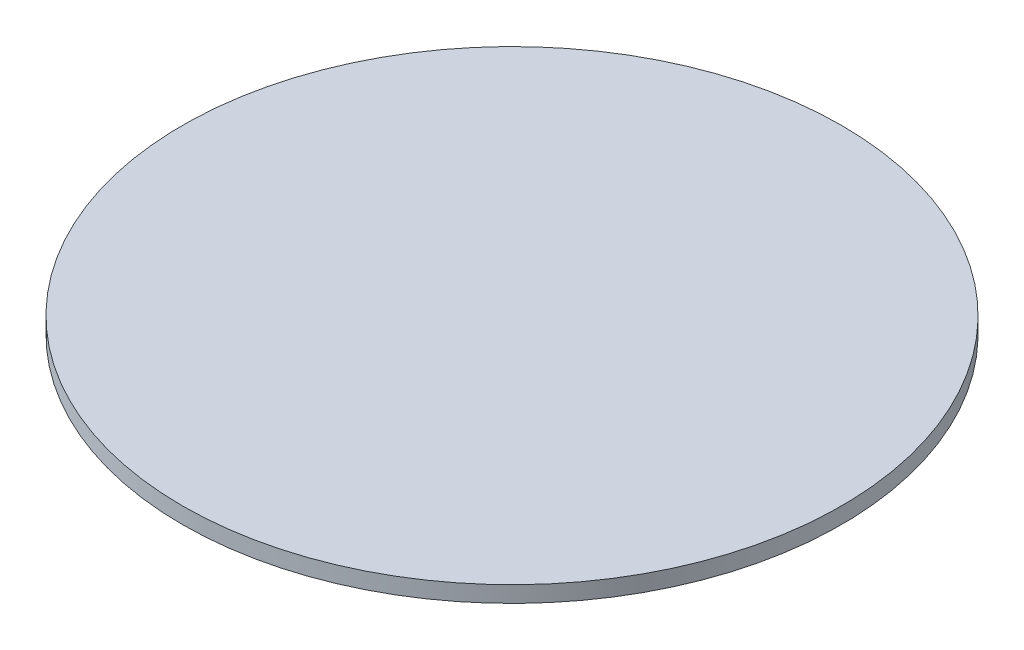
from build123d import *

# Parameters (mm, degrees)
SKETCH1_R           = 32.5
BOSS_EXTRUDE1_DEPTH = 1.6


with BuildPart() as part:
    # Sketch1 → Boss-Extrude1 (new body)
    with BuildSketch(Plane(origin=(0, 0, 0), x_dir=(1, 0, 0), z_dir=(0, 1, 0))):
        with Locations(Location((0, 0, 0), (0, 0, 270))):
            Circle(SKETCH1_R)
    extrude(amount=BOSS_EXTRUDE1_DEPTH)


solid = part.part
